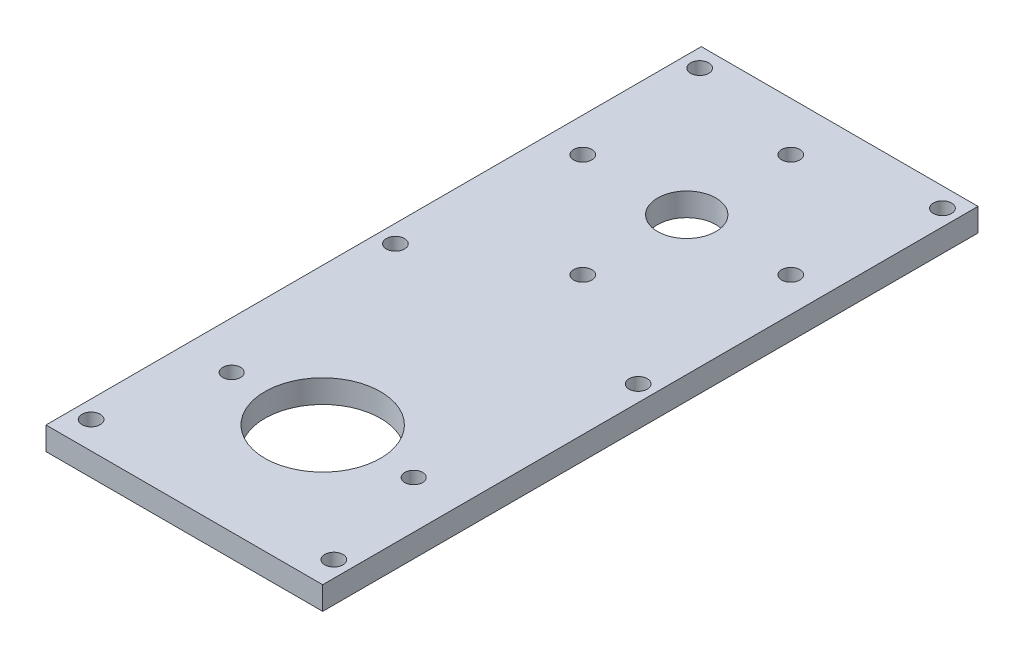
from build123d import *

# Parameters (mm, degrees)
SKETCH1_R           = 1.25
SKETCH1_R_2         = 1.22
SKETCH1_R_3         = 4
BOSS_EXTRUDE1_DEPTH = 3.175


with BuildPart() as part:
    # Sketch1 → Boss-Extrude1 (new body)
    with BuildSketch(Plane(origin=(0, 0, 0), x_dir=(1, 0, 0), z_dir=(0, 1, 0))):
        Polygon((-19, -19), (0, -19), (19, -19), (19, 71), (-19, 71), align=None)
        with Locations((-16.556995364, -15.248859434)):
            Circle(SKETCH1_R, mode=Mode.SUBTRACT)
        with Locations((-12.5, 0)):
            Circle(SKETCH1_R_2, mode=Mode.SUBTRACT)
        with BuildLine():
            ThreePointArc((7.9375, 0), (5.612660076, -5.612660076), (0, -7.9375))
            ThreePointArc((0, -7.9375), (-5.612660076, -5.612660076), (-7.9375, 0))
            ThreePointArc((-7.9375, 0), (-5.612660076, 5.612660076), (0, 7.9375))
            ThreePointArc((0, 7.9375), (5.612660076, 5.612660076), (7.9375, 0))
        make_face(mode=Mode.SUBTRACT)
        with Locations((16.785315207, -15.248859434)):
            Circle(SKETCH1_R, mode=Mode.SUBTRACT)
        with Locations((12.5, 0)):
            Circle(SKETCH1_R_2, mode=Mode.SUBTRACT)
        with BuildLine():
            ThreePointArc((-16.556995364, 25.292624917), (-17.806995364, 26.542624917), (-16.556995364, 27.792624917))
            ThreePointArc((-16.556995364, 27.792624917), (-15.306995364, 26.542624917), (-16.556995364, 25.292624917))
        make_face(mode=Mode.SUBTRACT)
        with BuildLine():
            ThreePointArc((-16.556995364, 67.084109267), (-17.440878841, 69.217992744), (-15.306995364, 68.334109267))
            ThreePointArc((-15.306995364, 68.334109267), (-15.673111888, 67.450225791), (-16.556995364, 67.084109267))
        make_face(mode=Mode.SUBTRACT)
        with BuildLine():
            ThreePointArc((16.785315207, 25.292624917), (15.535315207, 26.542624917), (16.785315207, 27.792624917))
            ThreePointArc((16.785315207, 27.792624917), (18.035315207, 26.542624917), (16.785315207, 25.292624917))
        make_face(mode=Mode.SUBTRACT)
        with Locations((0, 35.7125)):
            Circle(SKETCH1_R, mode=Mode.SUBTRACT)
        with Locations((14.2875, 50)):
            Circle(SKETCH1_R, mode=Mode.SUBTRACT)
        with Locations((0, 64.2875)):
            Circle(SKETCH1_R, mode=Mode.SUBTRACT)
        with Locations((-14.2875, 50)):
            Circle(SKETCH1_R, mode=Mode.SUBTRACT)
        with BuildLine():
            ThreePointArc((16.785315207, 67.084109267), (15.90143173, 67.450225791), (15.535315207, 68.334109267))
            ThreePointArc((15.535315207, 68.334109267), (17.669198683, 69.217992744), (16.785315207, 67.084109267))
        make_face(mode=Mode.SUBTRACT)
        with Locations((0, 50)):
            Circle(SKETCH1_R_3, mode=Mode.SUBTRACT)
    extrude(amount=BOSS_EXTRUDE1_DEPTH)


solid = part.part
